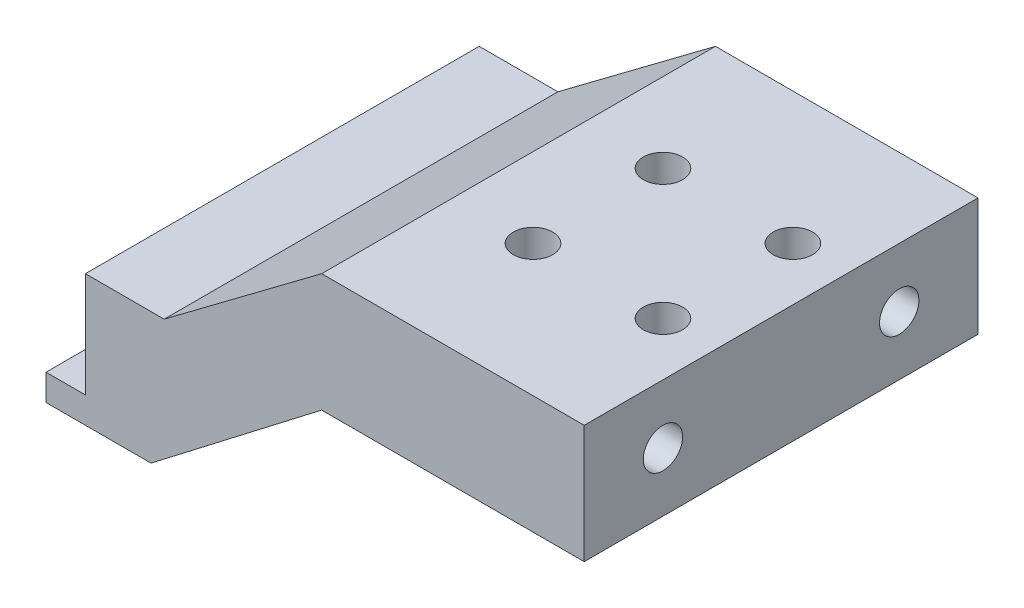
from build123d import *

# Parameters (mm, degrees)
SKETCH_1_W          = 41
SKETCH_1_H          = 30
SKETCH_1_R          = 1.5
EXTRUDE_1_DEPTH     = 10
SKETCH_3_W          = 30
SKETCH_3_H          = 8
CUT_EXTRUDE_2_DEPTH = 3
SKETCH_4_R          = 1
CUT_EXTRUDE_3_DEPTH = 7
EXTRUDE_3_DEPTH     = 30
SKETCH_6_W          = 20
SKETCH_6_H          = 30
CUT_EXTRUDE_5_DEPTH = 10
SKETCH_2_R          = 1.5
CUT_EXTRUDE_1_DEPTH = 6
SKETCH_8_R          = 1.5
CUT_EXTRUDE_6_DEPTH = 55.240206489
CUT_EXTRUDE_7_DEPTH = 55.240206489


with BuildPart() as part:
    # Эскиз1 → Бобышка-Вытянуть1 (new body)
    with BuildSketch(Plane(origin=(0, 0, 0), x_dir=(1, 0, 0), z_dir=(0, 1, 0))):
        with Locations((20.5, 15)):
            Rectangle(SKETCH_1_W, SKETCH_1_H)
        with Locations(Location((36.949747468, 19.949747468, 0), (0, 0, 270))):
            Circle(SKETCH_1_R, mode=Mode.SUBTRACT)
        with Locations(Location((27.050252532, 19.949747468, 0), (0, 0, 270))):
            Circle(SKETCH_1_R, mode=Mode.SUBTRACT)
        with Locations(Location((36.949747468, 10.050252532, 0), (0, 0, 270))):
            Circle(SKETCH_1_R, mode=Mode.SUBTRACT)
        with Locations(Location((27.050252532, 10.050252532, 0), (0, 0, 270))):
            Circle(SKETCH_1_R, mode=Mode.SUBTRACT)
    extrude(amount=EXTRUDE_1_DEPTH)

    # Эскиз3 → Вырез-Вытянуть2 (cut)
    with BuildSketch(Plane.ZY):
        with Locations((-15, 6)):
            Rectangle(SKETCH_3_W, SKETCH_3_H)
    extrude(amount=-CUT_EXTRUDE_2_DEPTH, mode=Mode.SUBTRACT)

    # Эскиз4 → Вырез-Вытянуть3 (cut)
    with BuildSketch(Plane.ZY):
        with Locations((-20, 5.4)):
            Circle(SKETCH_4_R)
        with Locations((-10, 5.4)):
            Circle(SKETCH_4_R)
    extrude(amount=-CUT_EXTRUDE_3_DEPTH, mode=Mode.SUBTRACT)

    # Эскиз7 → Бобышка-Вытянуть3 (add)
    with BuildSketch(Plane(origin=(0, 0, -30), x_dir=(-1, 0, 0), z_dir=(0, 0, -1))):
        Polygon((-41, 10), (-41, 19), (-21, 19), (-9, 10), align=None)
    extrude(amount=-EXTRUDE_3_DEPTH)

    # Эскиз6 → Вырез-Вытянуть5 (cut)
    with BuildSketch(Plane.XZ):
        with Locations((31, -15)):
            Rectangle(SKETCH_6_W, SKETCH_6_H)
    extrude(amount=-CUT_EXTRUDE_5_DEPTH, mode=Mode.SUBTRACT)

    # Эскиз2 → Вырез-Вытянуть1 (cut)
    with BuildSketch(Plane(origin=(41, 0, 0), x_dir=(0, 0, -1), z_dir=(1, 0, 0))):
        with Locations((6, 14.5)):
            Circle(SKETCH_2_R)
        with Locations((24, 14.5)):
            Circle(SKETCH_2_R)
    extrude(amount=-CUT_EXTRUDE_1_DEPTH, mode=Mode.SUBTRACT)

    # Эскиз8 → Вырез-Вытянуть6 (cut, through all)
    with BuildSketch(Plane(origin=(0, 19, 0), x_dir=(1, 0, 0), z_dir=(0, 1, 0))):
        with Locations(Location((36.949747468, 19.949747468, 0), (0, 0, 270))):
            Circle(SKETCH_8_R)
        with Locations(Location((36.949747468, 10.050252532, 0), (0, 0, 270))):
            Circle(SKETCH_8_R)
        with Locations(Location((27.050252532, 10.050252532, 0), (0, 0, 270))):
            Circle(SKETCH_8_R)
        with Locations(Location((27.050252532, 19.949747468, 0), (0, 0, 270))):
            Circle(SKETCH_8_R)
    extrude(amount=-CUT_EXTRUDE_6_DEPTH, mode=Mode.SUBTRACT)

    # Эскиз9 → Вырез-Вытянуть7 (cut, through all)
    with BuildSketch(Plane(origin=(0, 0, -30), x_dir=(-1, 0, 0), z_dir=(0, 0, -1))):
        Polygon((-21, 10), (-21, 0), (-8, 0), align=None)
    extrude(amount=-CUT_EXTRUDE_7_DEPTH, mode=Mode.SUBTRACT)


solid = part.part
